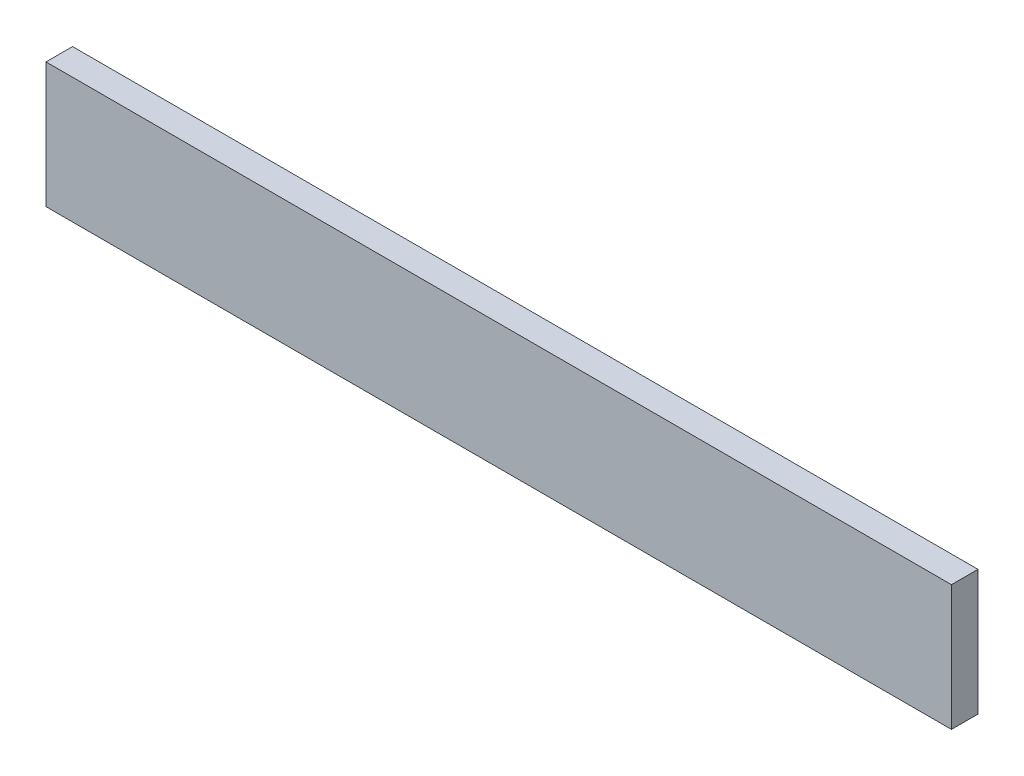
from build123d import *

# Parameters (mm, degrees)
SKETCH1_W           = 650
SKETCH1_H           = 90
BOSS_EXTRUDE1_DEPTH = 19.05


with BuildPart() as part:
    # Sketch1 → Boss-Extrude1 (new body)
    with BuildSketch(Plane.XY):
        with Locations((0, 45)):
            Rectangle(SKETCH1_W, SKETCH1_H)
    extrude(amount=BOSS_EXTRUDE1_DEPTH)


solid = part.part
